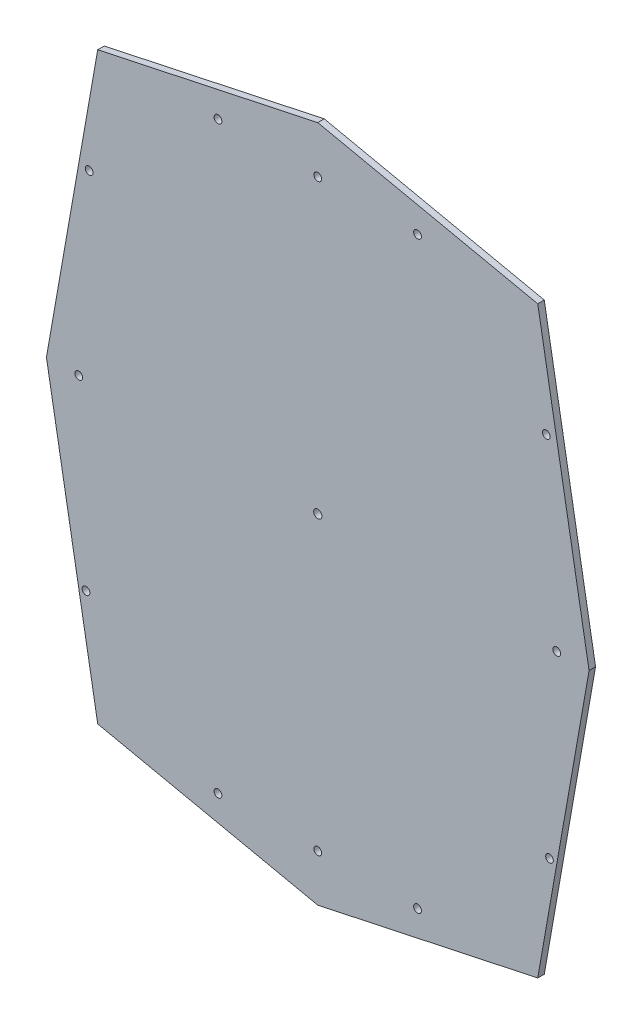
from build123d import *

# Parameters (mm, degrees)
SKETCH1_R              = 1.89865
SKETCH1_R_2            = 1.869185851
MAINBODY_DEPTH         = 3.175
F_10_32_TAPPED_HOLE1_D = 4.0386


with BuildPart() as part:
    # Sketch1 → MainBody (new body)
    with BuildSketch(Plane.XY.offset(-617.860281703)):
        Polygon((-107.5, 142.639876692), (-132.56321938, 0), (-107.5, -142.639876692), (0, -165.569938346), (107.5, -142.639876692), (132.56321938, 0), (107.5, 142.639876692), (0, 165.569938346), align=None)
        with Locations((48.75, -142.639876692)):
            Circle(SKETCH1_R, mode=Mode.SUBTRACT)
        with Locations((0, -142.639876692)):
            Circle(SKETCH1_R, mode=Mode.SUBTRACT)
        with Locations((-48.75, -142.639876692)):
            Circle(SKETCH1_R, mode=Mode.SUBTRACT)
        with Locations((-113.226895498, -89.153367391)):
            Circle(SKETCH1_R, mode=Mode.SUBTRACT)
        with Locations((-116.750007419, 0.165666821)):
            Circle(SKETCH1_R, mode=Mode.SUBTRACT)
        with Locations((-111.690160304, 89.410835528)):
            Circle(SKETCH1_R, mode=Mode.SUBTRACT)
        with Locations((111.690160304, 89.410835528)):
            Circle(SKETCH1_R, mode=Mode.SUBTRACT)
        with Locations((116.750007419, 0.165666821)):
            Circle(SKETCH1_R, mode=Mode.SUBTRACT)
        with Locations((113.226895498, -89.153367391)):
            Circle(SKETCH1_R_2, mode=Mode.SUBTRACT)
        with Locations((48.75, 142.639876692)):
            Circle(SKETCH1_R, mode=Mode.SUBTRACT)
        with Locations((0, 142.639876692)):
            Circle(SKETCH1_R, mode=Mode.SUBTRACT)
        with Locations((-48.75, 142.639876692)):
            Circle(SKETCH1_R, mode=Mode.SUBTRACT)
    extrude(amount=MAINBODY_DEPTH)

    # #10-32 Tapped Hole1 (through all)
    with Locations(Plane.XY.offset(-614.685281703)):
        with Locations((0, 0)):
            Hole(F_10_32_TAPPED_HOLE1_D / 2)


solid = part.part
